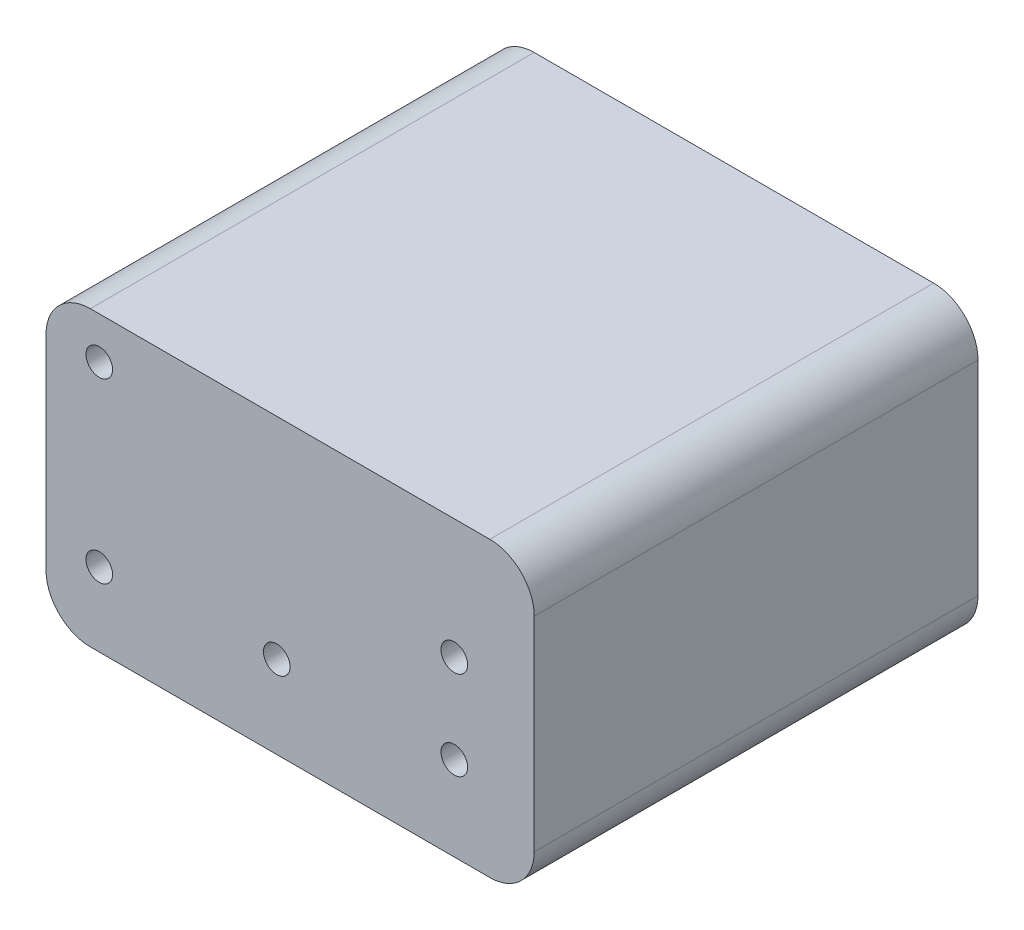
from build123d import *

# Parameters (mm, degrees)
ESQUISSE1_W             = 55
ESQUISSE1_H             = 33
BOSS_EXTRU_1_DEPTH      = 50
ENL_V_MAT_EXTRU_2_DEPTH = 45
CONG_1_R                = 5
ESQUISSE3_R             = 1.5
ENL_V_MAT_EXTRU_3_DEPTH = 10
ENL_V_MAT_EXTRU_4_DEPTH = 2
ESQUISSE5_R             = 1.5
ENL_V_MAT_EXTRU_5_DEPTH = 4
ESQUISSE6_R             = 1.5
ENL_V_MAT_EXTRU_7_DEPTH = 4


with BuildPart() as part:
    # Esquisse1 → Boss.-Extru.1 (new body)
    with BuildSketch(Plane.XY):
        with Locations((-27.5, 16.5)):
            Rectangle(ESQUISSE1_W, ESQUISSE1_H)
    extrude(amount=BOSS_EXTRU_1_DEPTH)

    # Esquisse2 → Enlèv. mat.-Extru.2 (cut)
    with BuildSketch(Plane.XY):
        with BuildLine():
            Line((-38, 29), (-16, 29))
            ThreePointArc((-16, 29), (-3.5, 16.5), (-16, 4))
            Line((-16, 4), (-38, 4))
            ThreePointArc((-38, 4), (-50.5, 16.5), (-38, 29))
        make_face()
    extrude(amount=ENL_V_MAT_EXTRU_2_DEPTH, mode=Mode.SUBTRACT)

    # Congé1
    cong_1_edges = [part.edges().sort_by_distance(p)[0] for p in [
        (0, 0, 25),
        (-55, 0, 25),
        (-55, 33, 25),
        (0, 33, 25),
    ]]
    fillet(cong_1_edges, radius=CONG_1_R)

    # Esquisse3 → Enlèv. mat.-Extru.3 (cut)
    with BuildSketch(Plane.XY.offset(50)):
        with Locations((-29, 9.3)):
            Circle(ESQUISSE3_R)
        with Locations((-9, 19.5)):
            Circle(ESQUISSE3_R)
        with Locations((-9, 9.5)):
            Circle(ESQUISSE3_R)
    extrude(amount=-ENL_V_MAT_EXTRU_3_DEPTH, mode=Mode.SUBTRACT)

    # Esquisse4 → Enlèv. mat.-Extru.4 (cut)
    with BuildSketch(Plane(origin=(0, 0, 45), x_dir=(-1, 0, 0), z_dir=(0, 0, -1))):
        Polygon((27.354551733, 6.45), (30.645448267, 6.45), (32.290896534, 9.3), (30.645448267, 12.15), (27.354551733, 12.15), (25.709103466, 9.3), align=None)
        Polygon((7.354551733, 6.65), (10.645448267, 6.65), (12.290896534, 9.5), (10.645448267, 12.35), (7.354551733, 12.35), (5.709103466, 9.5), align=None)
        Polygon((7.354551733, 16.65), (10.645448267, 16.65), (12.290896534, 19.5), (10.645448267, 22.35), (7.354551733, 22.35), (5.709103466, 19.5), align=None)
    extrude(amount=-ENL_V_MAT_EXTRU_4_DEPTH, mode=Mode.SUBTRACT)

    # Esquisse5 → Enlèv. mat.-Extru.5 (cut)
    with BuildSketch(Plane.XY.offset(50)):
        with Locations((-49, 28.3)):
            Circle(ESQUISSE5_R)
        with Locations((-49, 8.3)):
            Circle(ESQUISSE5_R)
    extrude(amount=-ENL_V_MAT_EXTRU_5_DEPTH, mode=Mode.SUBTRACT)

    # Esquisse6 → Enlèv. mat.-Extru.7 (cut)
    with BuildSketch(Plane.XY.offset(46)):
        with Locations((-49, 28.3)):
            Circle(ESQUISSE6_R)
        with Locations((-49, 8.3)):
            Circle(ESQUISSE6_R)
    extrude(amount=-ENL_V_MAT_EXTRU_7_DEPTH, mode=Mode.SUBTRACT)


solid = part.part
